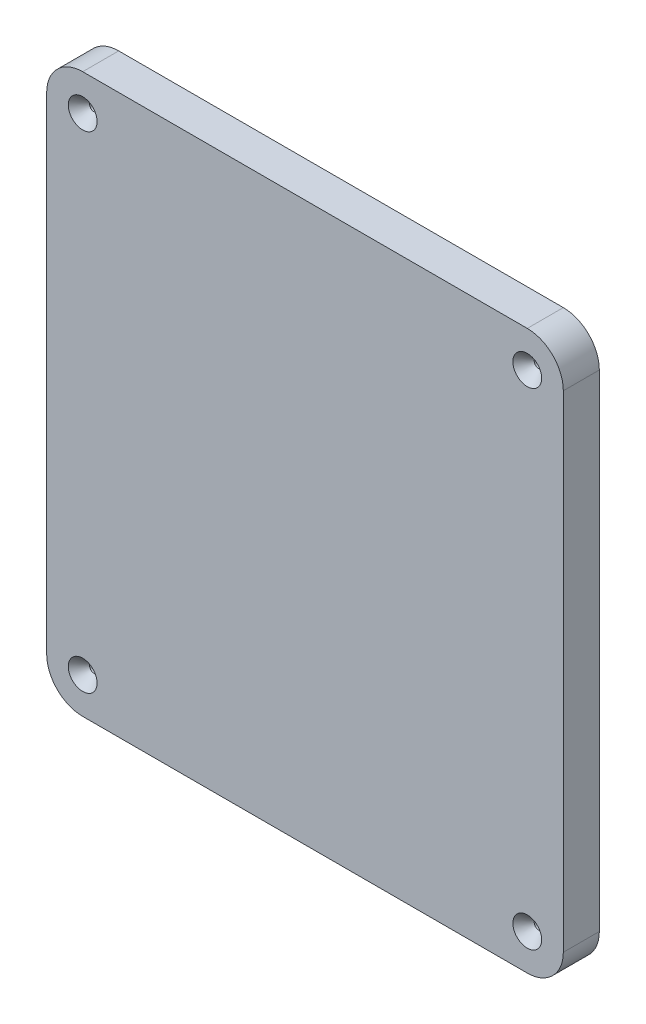
from build123d import *

# Parameters (mm, degrees)
SKETCH1_W           = 182.149999994
SKETCH1_H           = 196.85
BOSS_EXTRUDE1_DEPTH = 12.7
FILLET1_R           = 12.7
HOLE1_D             = 3.175
HOLE1_DEPTH         = 31.75
HOLE1_CSINK_D       = 10.16
HOLE1_CSINK_ANGLE   = 82
HOLE1_TIP           = 0.953866233


with BuildPart() as part:
    # Sketch1 → Boss-Extrude1 (new body)
    with BuildSketch(Plane.XY):
        with Locations((47.975000003, 766.50216301)):
            Rectangle(SKETCH1_W, SKETCH1_H)
    extrude(amount=BOSS_EXTRUDE1_DEPTH)

    # Fillet1
    fillet1_edges = [part.edges().sort_by_distance(p)[0] for p in [
        (-43.099999994, 668.07716301, 6.35),
        (-43.099999994, 864.92716301, 6.35),
        (139.05, 864.92716301, 6.35),
        (139.05, 668.07716301, 6.35),
    ]]
    fillet(fillet1_edges, radius=FILLET1_R)

    # Hole1
    with Locations(Plane(origin=(47.975000003, -440.812032837, 12.7), x_dir=(1, 0, 0), z_dir=(0, 0, 1))):
        with Locations((-78.374999997, 1293.039195846), (-78.374999997, 1121.589195846), (78.374999997, 1121.589195846), (78.374999997, 1293.039195846), (-764.015524801, 1530.078195669)):
            CounterSinkHole(HOLE1_D / 2, HOLE1_CSINK_D / 2, depth=HOLE1_DEPTH, counter_sink_angle=HOLE1_CSINK_ANGLE)
            with Locations((0, 0, -(HOLE1_DEPTH + HOLE1_TIP / 2))):  # 118° drill point
                Cone(0, HOLE1_D / 2, HOLE1_TIP, mode=Mode.SUBTRACT)


solid = part.part
